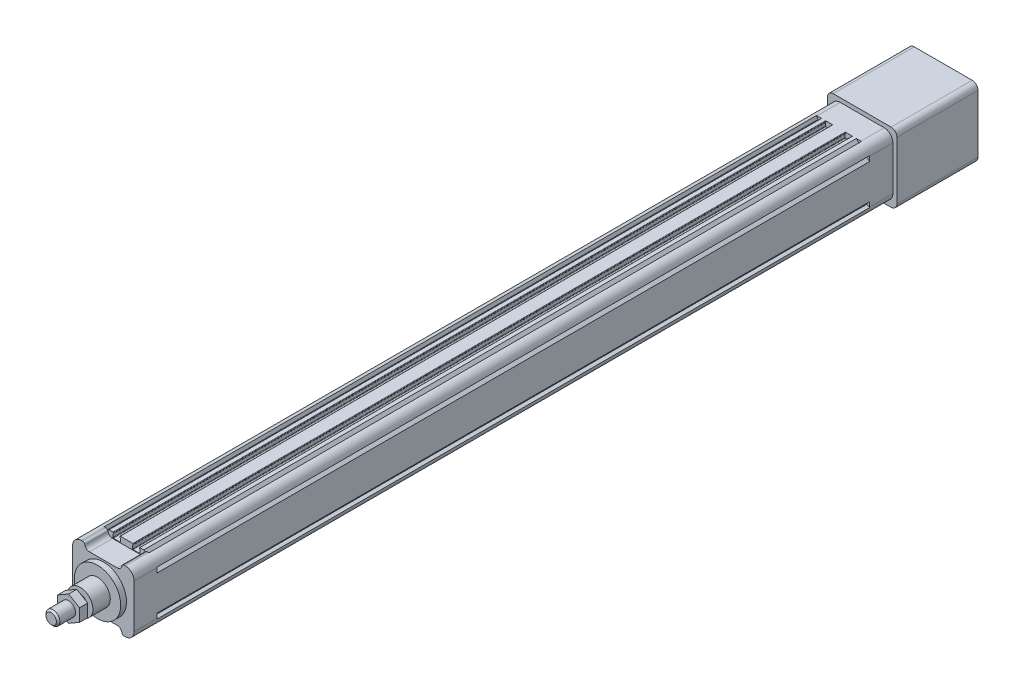
from build123d import *

# Parameters (mm, degrees)
SKETCH_1_R             = 2.1
EXTRUDE_1_DEPTH        = 615
EXTRUDE_2_DEPTH        = 20
SKETCH_7_R             = 20
EXTRUDE_3_DEPTH        = 5
SKETCH_9_R             = 11
EXTRUDE_4_DEPTH        = 15
SKETCH_10_R            = 6
EXTRUDE_5_DEPTH        = 25
EXTRUDE_START          = 20
EXTRUDE_6_DEPTH        = 20
EXTRUDE_7_DEPTH        = 70
SKETCH_14_R            = 19
CUT_EXTRUDE_2_DEPTH    = 70
HOLE_WIZARD_M6_1_D     = 5
HOLE_WIZARD_M6_1_DEPTH = 15
HOLE_WIZARD_M6_1_TIP   = 1.502151548
CHAMFER_1_SIZE         = 1.5
EXTRUDE_START_2        = 3
EXTRUDE_8_DEPTH        = 7


with BuildPart() as part:
    # 草图1 → 凸台-拉伸1 (new body)
    with BuildSketch(Plane.XY):
        with BuildLine():
            Line((-18.2, 24), (-19.443439638, 26.486879276))
            ThreePointArc((-19.443439638, 26.486879276), (-24.303300859, 24.303300859), (-26.486879276, 19.443439638))
            Line((-26.486879276, 19.443439638), (-24, 18.2))
            Line((-24, 18.2), (-24, 17.1))
            Line((-24, 17.1), (-26.5, 15))
            Line((-26.5, 15), (-26.5, -15))
            Line((-26.5, -15), (-24, -17.1))
            Line((-24, -17.1), (-24, -18.2))
            Line((-24, -18.2), (-26.486879276, -19.443439638))
            ThreePointArc((-26.486879276, -19.443439638), (-24.303300859, -24.303300859), (-19.443439638, -26.486879276))
            Line((-19.443439638, -26.486879276), (-18.2, -24))
            Line((-18.2, -24), (-17.1, -24))
            Line((-17.1, -24), (-15, -26.5))
            Line((-15, -26.5), (-11.65, -26.5))
            ThreePointArc((-11.65, -26.5), (-11.367157288, -26.382842712), (-11.25, -26.1))
            Line((-11.25, -26.1), (-11.25, -25.6))
            ThreePointArc((-11.25, -25.6), (-11.367157288, -25.317157288), (-11.65, -25.2))
            Line((-11.65, -25.2), (-11.75, -25.2))
            Line((-11.75, -25.2), (-11.75, -22.4))
            ThreePointArc((-11.75, -22.4), (-11.632842712, -22.117157288), (-11.35, -22))
            Line((-11.35, -22), (-5.65, -22))
            ThreePointArc((-5.65, -22), (-5.367157288, -22.117157288), (-5.25, -22.4))
            Line((-5.25, -22.4), (-5.25, -25.2))
            Line((-5.25, -25.2), (-5.35, -25.2))
            ThreePointArc((-5.35, -25.2), (-5.632842712, -25.317157288), (-5.75, -25.6))
            Line((-5.75, -25.6), (-5.75, -26.1))
            ThreePointArc((-5.75, -26.1), (-5.632842712, -26.382842712), (-5.35, -26.5))
            Line((-5.35, -26.5), (5.35, -26.5))
            ThreePointArc((5.35, -26.5), (5.632842712, -26.382842712), (5.75, -26.1))
            Line((5.75, -26.1), (5.75, -25.6))
            ThreePointArc((5.75, -25.6), (5.632842712, -25.317157288), (5.35, -25.2))
            Line((5.35, -25.2), (5.25, -25.2))
            Line((5.25, -25.2), (5.25, -22.4))
            ThreePointArc((5.25, -22.4), (5.367157288, -22.117157288), (5.65, -22))
            Line((5.65, -22), (11.35, -22))
            ThreePointArc((11.35, -22), (11.632842712, -22.117157288), (11.75, -22.4))
            Line((11.75, -22.4), (11.75, -25.2))
            Line((11.75, -25.2), (11.65, -25.2))
            ThreePointArc((11.65, -25.2), (11.367157288, -25.317157288), (11.25, -25.6))
            Line((11.25, -25.6), (11.25, -26.1))
            ThreePointArc((11.25, -26.1), (11.367157288, -26.382842712), (11.65, -26.5))
            Line((11.65, -26.5), (15, -26.5))
            Line((15, -26.5), (17.1, -24))
            Line((17.1, -24), (18.2, -24))
            Line((18.2, -24), (19.443439638, -26.486879276))
            ThreePointArc((19.443439638, -26.486879276), (24.303300859, -24.303300859), (26.486879276, -19.443439638))
            Line((26.486879276, -19.443439638), (24, -18.2))
            Line((24, -18.2), (24, -17.1))
            Line((24, -17.1), (26.5, -15))
            Line((26.5, -15), (26.5, 15))
            Line((26.5, 15), (24, 17.1))
            Line((24, 17.1), (24, 18.2))
            Line((24, 18.2), (26.486879276, 19.443439638))
            ThreePointArc((26.486879276, 19.443439638), (24.303300859, 24.303300859), (19.443439638, 26.486879276))
            Line((19.443439638, 26.486879276), (18.2, 24))
            Line((18.2, 24), (17.1, 24))
            Line((17.1, 24), (15, 26.5))
            Line((15, 26.5), (11.65, 26.5))
            ThreePointArc((11.65, 26.5), (11.367157288, 26.382842712), (11.25, 26.1))
            Line((11.25, 26.1), (11.25, 25.6))
            ThreePointArc((11.25, 25.6), (11.367157288, 25.317157288), (11.65, 25.2))
            Line((11.65, 25.2), (11.75, 25.2))
            Line((11.75, 25.2), (11.75, 22.4))
            ThreePointArc((11.75, 22.4), (11.632842712, 22.117157288), (11.35, 22))
            Line((11.35, 22), (5.65, 22))
            ThreePointArc((5.65, 22), (5.367157288, 22.117157288), (5.25, 22.4))
            Line((5.25, 22.4), (5.25, 25.2))
            Line((5.25, 25.2), (5.35, 25.2))
            ThreePointArc((5.35, 25.2), (5.632842712, 25.317157288), (5.75, 25.6))
            Line((5.75, 25.6), (5.75, 26.1))
            ThreePointArc((5.75, 26.1), (5.632842712, 26.382842712), (5.35, 26.5))
            Line((5.35, 26.5), (-5.35, 26.5))
            ThreePointArc((-5.35, 26.5), (-5.632842712, 26.382842712), (-5.75, 26.1))
            Line((-5.75, 26.1), (-5.75, 25.6))
            ThreePointArc((-5.75, 25.6), (-5.632842712, 25.317157288), (-5.35, 25.2))
            Line((-5.35, 25.2), (-5.25, 25.2))
            Line((-5.25, 25.2), (-5.25, 22.4))
            ThreePointArc((-5.25, 22.4), (-5.367157288, 22.117157288), (-5.65, 22))
            Line((-5.65, 22), (-11.35, 22))
            ThreePointArc((-11.35, 22), (-11.632842712, 22.117157288), (-11.75, 22.4))
            Line((-11.75, 22.4), (-11.75, 25.2))
            Line((-11.75, 25.2), (-11.65, 25.2))
            ThreePointArc((-11.65, 25.2), (-11.367157288, 25.317157288), (-11.25, 25.6))
            Line((-11.25, 25.6), (-11.25, 26.1))
            ThreePointArc((-11.25, 26.1), (-11.367157288, 26.382842712), (-11.65, 26.5))
            Line((-11.65, 26.5), (-15, 26.5))
            Line((-15, 26.5), (-17.1, 24))
            Line((-17.1, 24), (-18.2, 24))
        make_face()
        with Locations((19, 19)):
            Circle(SKETCH_1_R, mode=Mode.SUBTRACT)
        with Locations((19, -19)):
            Circle(SKETCH_1_R, mode=Mode.SUBTRACT)
        with Locations((-19, -19)):
            Circle(SKETCH_1_R, mode=Mode.SUBTRACT)
        with Locations((-19, 19)):
            Circle(SKETCH_1_R, mode=Mode.SUBTRACT)
        with BuildLine():
            Line((19.773719933, 3), (23.3, 3))
            Line((23.3, 3), (23.3, -3))
            Line((23.3, -3), (19.773719933, -3))
            ThreePointArc((19.773719933, -3), (0, -20), (-19.773719933, -3))
            Line((-19.773719933, -3), (-23.3, -3))
            Line((-23.3, -3), (-23.3, 3))
            Line((-23.3, 3), (-19.773719933, 3))
            ThreePointArc((-19.773719933, 3), (0, 20), (19.773719933, 3))
        make_face(mode=Mode.SUBTRACT)
    extrude(amount=EXTRUDE_1_DEPTH)

    # 草图6 → 凸台-拉伸2 (add)
    with BuildSketch(Plane.XY.offset(615)):
        with BuildLine():
            Line((-26.5, -19), (-26.5, 19))
            ThreePointArc((-26.5, 19), (-24.303300859, 24.303300859), (-19, 26.5))
            Line((-19, 26.5), (-17.916079783, 26.5))
            ThreePointArc((-17.916079783, 26.5), (-16.625085334, 26.027525232), (-15.944053189, 24.833333333))
            ThreePointArc((-15.944053189, 24.833333333), (-14.581988897, 22.444949537), (-12, 21.5))
            Line((-12, 21.5), (12, 21.5))
            ThreePointArc((12, 21.5), (14.581988897, 22.444949537), (15.944053189, 24.833333333))
            ThreePointArc((15.944053189, 24.833333333), (16.625085334, 26.027525232), (17.916079783, 26.5))
            Line((17.916079783, 26.5), (19, 26.5))
            ThreePointArc((19, 26.5), (24.303300859, 24.303300859), (26.5, 19))
            Line((26.5, 19), (26.5, -19))
            ThreePointArc((26.5, -19), (24.303300859, -24.303300859), (19, -26.5))
            Line((19, -26.5), (17.916079783, -26.5))
            ThreePointArc((17.916079783, -26.5), (16.625085334, -26.027525232), (15.944053189, -24.833333333))
            ThreePointArc((15.944053189, -24.833333333), (14.581988897, -22.444949537), (12, -21.5))
            Line((12, -21.5), (-12, -21.5))
            ThreePointArc((-12, -21.5), (-14.581988897, -22.444949537), (-15.944053189, -24.833333333))
            ThreePointArc((-15.944053189, -24.833333333), (-16.625085334, -26.027525232), (-17.916079783, -26.5))
            Line((-17.916079783, -26.5), (-19, -26.5))
            ThreePointArc((-19, -26.5), (-24.303300859, -24.303300859), (-26.5, -19))
        make_face()
    extrude(amount=EXTRUDE_2_DEPTH)

    # 草图7 → 凸台-拉伸3 (add)
    with BuildSketch(Plane.XY.offset(635)):
        Circle(SKETCH_7_R)
    extrude(amount=EXTRUDE_3_DEPTH)

    # 草图9 → 凸台-拉伸4 (add)
    with BuildSketch(Plane.XY.offset(640)):
        Circle(SKETCH_9_R)
    extrude(amount=EXTRUDE_4_DEPTH)

    # 草图10 → 凸台-拉伸5 (add)
    with BuildSketch(Plane.XY.offset(655)):
        Circle(SKETCH_10_R)
    extrude(amount=EXTRUDE_5_DEPTH)

    # 草图11 → 凸台-拉伸6 (add)
    with BuildSketch(Plane(origin=(0, 0, 0), x_dir=(-1, 0, 0), z_dir=(0, 0, -1)).offset(EXTRUDE_START)):
        with BuildLine():
            Line((-19, -26.5), (19, -26.5))
            ThreePointArc((19, -26.5), (24.303300859, -24.303300859), (26.5, -19))
            Line((26.5, -19), (26.5, 19))
            ThreePointArc((26.5, 19), (24.303300859, 24.303300859), (19, 26.5))
            Line((19, 26.5), (-19, 26.5))
            ThreePointArc((-19, 26.5), (-24.303300859, 24.303300859), (-26.5, 19))
            Line((-26.5, 19), (-26.5, -19))
            ThreePointArc((-26.5, -19), (-24.303300859, -24.303300859), (-19, -26.5))
        make_face()
    extrude(amount=-EXTRUDE_6_DEPTH)

    # 草图12 → 凸台-拉伸7 (add)
    with BuildSketch(Plane(origin=(0, 0, -20), x_dir=(-1, 0, 0), z_dir=(0, 0, -1))):
        with BuildLine():
            Line((-25, -30), (25, -30))
            ThreePointArc((25, -30), (28.535533906, -28.535533906), (30, -25))
            Line((30, -25), (30, 25))
            ThreePointArc((30, 25), (28.535533906, 28.535533906), (25, 30))
            Line((25, 30), (-25, 30))
            ThreePointArc((-25, 30), (-28.535533906, 28.535533906), (-30, 25))
            Line((-30, 25), (-30, -25))
            ThreePointArc((-30, -25), (-28.535533906, -28.535533906), (-25, -30))
        make_face()
    extrude(amount=EXTRUDE_7_DEPTH)

    # 草图14 → 切除-拉伸2 (cut)
    with BuildSketch(Plane(origin=(0, 0, -90), x_dir=(-1, 0, 0), z_dir=(0, 0, -1))):
        Circle(SKETCH_14_R)
    extrude(amount=-CUT_EXTRUDE_2_DEPTH, mode=Mode.SUBTRACT)

    # M6 螺纹孔1
    with Locations(Plane.ZY.offset(26.5)):
        with Locations((625, 11), (625, -11), (-10, 11), (-10, -11)):
            Hole(HOLE_WIZARD_M6_1_D / 2, depth=HOLE_WIZARD_M6_1_DEPTH)
            with Locations((0, 0, -(HOLE_WIZARD_M6_1_DEPTH + HOLE_WIZARD_M6_1_TIP / 2))):  # 118° drill point
                Cone(0, HOLE_WIZARD_M6_1_D / 2, HOLE_WIZARD_M6_1_TIP, mode=Mode.SUBTRACT)

    # 倒角1
    chamfer_1_edges = [part.edges().sort_by_distance(p)[0] for p in [
        (-6, 0, 680),
    ]]
    chamfer(chamfer_1_edges, length=CHAMFER_1_SIZE)

    # 草图17 → 凸台-拉伸8 (add)
    with BuildSketch(Plane.XY.offset(655).offset(EXTRUDE_START_2)):
        Polygon((0, 10.969655115), (-9.5, 5.484827557), (-9.5, -5.484827557), (0, -10.969655115), (9.5, -5.484827557), (9.5, 5.484827557), align=None)
    extrude(amount=EXTRUDE_8_DEPTH)


solid = part.part
